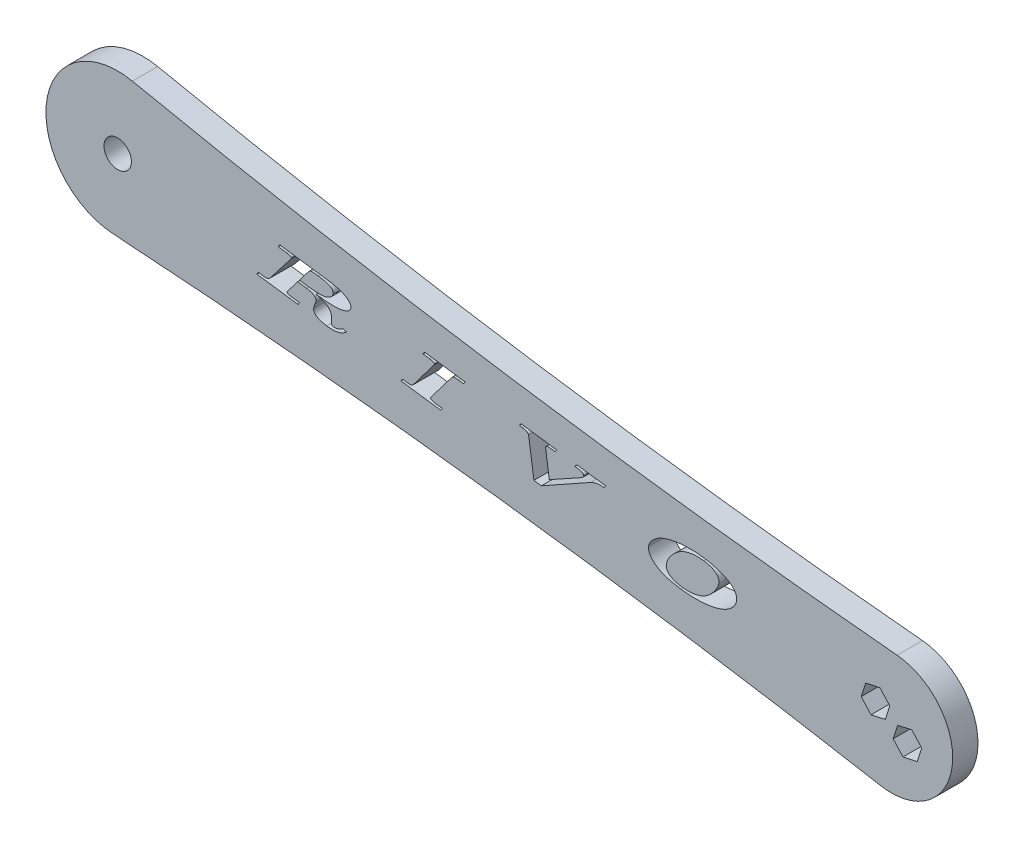
from build123d import *

# Parameters (mm, degrees)
SKETCH1_R           = 75
BOSS_EXTRUDE1_DEPTH = 6
BOSS_EXTRUDE2_DEPTH = 6
SKETCH3_R           = 92.134388464
CUT_EXTRUDE1_DEPTH  = 6
CUT_EXTRUDE2_DEPTH  = 6
SKETCH5_R           = 3.25
CUT_EXTRUDE3_DEPTH  = 149.252587559


with BuildPart() as part:
    # Sketch1 → Boss-Extrude1 (new body)
    with BuildSketch(Plane.XY):
        Circle(SKETCH1_R)
    extrude(amount=BOSS_EXTRUDE1_DEPTH)

    # Sketch2 → Boss-Extrude2 (add)
    with BuildSketch(Plane(origin=(0, 0, 0), x_dir=(-1, 0, 0), z_dir=(0, 0, -1))):
        with BuildLine():
            ThreePointArc((128.747209027, -9.416387205), (37.517810484, -17.965524255), (-53.074069815, -31.713328687))
            ThreePointArc((-53.074069815, -31.713328687), (-70.025516623, -19.404438893), (-56.988213603, -3.006602243))
            ThreePointArc((-56.988213603, -3.006602243), (33.977314711, 8.000829854), (124.165294646, 24.187836312))
            ThreePointArc((124.165294646, 24.187836312), (144.489624717, 9.844563411), (128.747209027, -9.416387205))
        make_face()
    extrude(amount=BOSS_EXTRUDE2_DEPTH)

    # Sketch3 → Cut-Extrude1 (cut)
    with BuildSketch(Plane.XY.offset(6)):
        Circle(SKETCH3_R)
    extrude(amount=-CUT_EXTRUDE1_DEPTH, mode=Mode.SUBTRACT)

    # Sketch4 → Cut-Extrude2 (cut)
    # profile 1 of 4: a face of its own
    with BuildSketch(Plane.XY):
        with BuildLine():
            Line((-89.199235465, 8.056350218), (-78.633328021, 6.61007346))
            add(Edge.make_bspline(
                [(-78.633328021, 6.61007346), (-78.46967753, 6.587082198), (-78.151590929, 6.542394203), (-77.689236729, 6.47400477), (-77.256539996, 6.400685191), (-76.851936412, 6.333885662), (-76.478357712, 6.25852778), (-76.132956577, 6.188507141), (-75.817031153, 6.11514295), (-75.616548577, 6.063172267), (-75.520729798, 6.038333363)],
                knots=[0, 0, 0, 0, 1.252522044, 2.434520528, 3.542164078, 4.578738111, 5.542259448, 6.430319151, 7.24978566, 8, 8, 8, 8], degree=3))
            add(Edge.make_bspline(
                [(-75.520729798, 6.038333363), (-75.395696417, 6.002255621), (-75.15122404, 5.931714369), (-74.797988079, 5.813162632), (-74.466458687, 5.687628696), (-74.157180162, 5.55372731), (-73.869121186, 5.413580031), (-73.60406241, 5.264544499), (-73.359321994, 5.111230758), (-73.140687987, 4.947303731), (-72.944171454, 4.781964658), (-72.777761586, 4.610579982), (-72.640999972, 4.436529345), (-72.531455627, 4.260865466), (-72.453109988, 4.080858684), (-72.406044219, 3.898117918), (-72.384686412, 3.712653718), (-72.396521626, 3.589610166), (-72.402489402, 3.52756682)],
                knots=[0, 0, 0, 0, 1.448769525, 2.832716552, 4.147188601, 5.394567615, 6.583904287, 7.712022436, 8.778948357, 9.796631487, 10.752067049, 11.635656237, 12.451084726, 13.212441746, 13.934654233, 14.627076443, 15.307718526, 16, 16, 16, 16], degree=3))
            add(Edge.make_bspline(
                [(-72.402489402, 3.52756682), (-72.412683853, 3.471960345), (-72.433057021, 3.36083322), (-72.495000346, 3.200657144), (-72.582702896, 3.050261087), (-72.693339621, 2.9060145), (-72.832434457, 2.774143122), (-72.993609833, 2.646638649), (-73.180513186, 2.528921963), (-73.392117805, 2.419981398), (-73.627638681, 2.32121473), (-73.885567435, 2.230698829), (-74.167314971, 2.152500023), (-74.471016737, 2.083223406), (-74.798003171, 2.024919962), (-75.148287654, 1.978787392), (-75.521520622, 1.94175629), (-75.920909388, 1.91263529), (-76.353768931, 1.897195352), (-76.827314074, 1.901295574), (-77.34532131, 1.915738988), (-77.907663282, 1.947482657), (-78.51480605, 1.989461141), (-79.165334221, 2.05173549), (-79.860178302, 2.12409087), (-80.337352757, 2.182693778), (-80.583638812, 2.212940743)],
                knots=[0, 0, 0, 0, 0.460768848, 0.920826524, 1.393133572, 1.878379936, 2.399569821, 2.953505336, 3.554089076, 4.199616045, 4.894506573, 5.637474017, 6.429784344, 7.280262957, 8.179792754, 9.14031503, 10.163942718, 11.241476693, 12.409115775, 13.698880695, 15.106946604, 16.639440317, 18.296764186, 20.075175391, 21.9742638, 24, 24, 24, 24], degree=3))
            add(Edge.make_bspline(
                [(-80.583638812, 2.212940743), (-80.462498605, 2.183431198), (-80.226392263, 2.1259161), (-79.885021715, 2.032505967), (-79.566752798, 1.934212253), (-79.270441852, 1.834743808), (-78.996324827, 1.732628453), (-78.745540701, 1.624096066), (-78.515752959, 1.517009821), (-78.308789751, 1.402313432), (-78.120008851, 1.285367883), (-77.945760102, 1.165411308), (-77.788674783, 1.03895043), (-77.64322324, 0.910659182), (-77.514811602, 0.776226696), (-77.400266799, 0.637363541), (-77.300745557, 0.494698073), (-77.212677203, 0.344247488), (-77.139817286, 0.176718343), (-77.082536842, -0.014655107), (-77.037904577, -0.232432671), (-77.006816545, -0.477621054), (-76.988719757, -0.750158645), (-76.983779907, -1.050133168), (-76.991297983, -1.377019731), (-77.006252716, -1.603718866), (-77.014024655, -1.72153387)],
                knots=[0, 0, 0, 0, 1.481242736, 2.886991985, 4.203931216, 5.438089803, 6.600088731, 7.6778042, 8.683911164, 9.610604467, 10.48693373, 11.321635508, 12.12189989, 12.881444329, 13.62418792, 14.327969556, 15.018061041, 15.688748474, 16.395832791, 17.182711017, 18.057678265, 19.03415483, 20.11667221, 21.301106396, 22.597391388, 24, 24, 24, 24], degree=3))
            add(Edge.make_bspline(
                [(-77.014024655, -1.72153387), (-77.014991635, -1.76736437), (-77.01682107, -1.85407139), (-76.99464735, -1.978819447), (-76.947158933, -2.087502567), (-76.876580963, -2.180944585), (-76.78471998, -2.259644388), (-76.668104801, -2.318692909), (-76.531784175, -2.366984965), (-76.431410633, -2.382740932), (-76.378339943, -2.391071614)],
                knots=[0, 0, 0, 0, 1.055741748, 1.997364664, 2.897429717, 3.765081255, 4.677949824, 5.661288235, 6.763448575, 8, 8, 8, 8], degree=3))
            add(Edge.make_bspline(
                [(-76.378339943, -2.391071614), (-76.301294195, -2.398974928), (-76.144751998, -2.415032947), (-75.904414487, -2.396785264), (-75.657620992, -2.351688172), (-75.405267112, -2.272941856), (-75.146371885, -2.164370777), (-74.881250333, -2.026197037), (-74.60874572, -1.858128095), (-74.431484687, -1.727273555), (-74.339635124, -1.659469978)],
                knots=[0, 0, 0, 0, 0.835137947, 1.696840279, 2.592029055, 3.540952508, 4.545759258, 5.620936426, 6.767264615, 8, 8, 8, 8], degree=3))
            Line((-74.339635124, -1.659469978), (-73.414318915, -1.905844822))
            add(Edge.make_bspline(
                [(-73.414318915, -1.905844822), (-73.485006791, -1.967602389), (-73.625871159, -2.090670745), (-73.851003223, -2.258269681), (-74.086531377, -2.411024818), (-74.333504303, -2.548550902), (-74.591794757, -2.670801483), (-74.860404687, -2.77834936), (-75.140562276, -2.867942837), (-75.430904008, -2.945759287), (-75.732911777, -3.007840949), (-76.045905746, -3.051509738), (-76.368881781, -3.084953436), (-76.703566853, -3.098896674), (-77.049240778, -3.098186911), (-77.405699397, -3.085855193), (-77.772721866, -3.055319341), (-78.020316875, -3.023917249), (-78.146220505, -3.007949087)],
                knots=[0, 0, 0, 0, 0.896627271, 1.786767998, 2.67900242, 3.57732889, 4.485665322, 5.407802043, 6.339808508, 7.294428838, 8.278897195, 9.283604995, 10.312974251, 11.380301643, 12.482493739, 13.615412946, 14.787422377, 16, 16, 16, 16], degree=3))
            add(Edge.make_bspline(
                [(-78.146220505, -3.007949087), (-78.272414709, -2.989623075), (-78.518108682, -2.95394322), (-78.872999646, -2.883598863), (-79.205373856, -2.805599045), (-79.513435184, -2.715278721), (-79.799023648, -2.616207467), (-80.060308886, -2.505438827), (-80.299099421, -2.385177546), (-80.5134072, -2.254287115), (-80.701672742, -2.114421456), (-80.86106845, -1.966195209), (-80.995343517, -1.814372497), (-81.098284319, -1.652347398), (-81.172710304, -1.48362674), (-81.218438029, -1.307842952), (-81.236503371, -1.125380975), (-81.22510377, -1.003058079), (-81.219323524, -0.941033409)],
                knots=[0, 0, 0, 0, 1.500131662, 2.920683313, 4.255335032, 5.515768824, 6.696180242, 7.810000424, 8.852412398, 9.839161177, 10.761177534, 11.606702226, 12.396361734, 13.139156789, 13.855895086, 14.557209601, 15.26842316, 16, 16, 16, 16], degree=3))
            add(Edge.make_bspline(
                [(-81.219323524, -0.941033409), (-81.208516596, -0.877469105), (-81.184622644, -0.736929411), (-81.118701797, -0.511779332), (-81.033198816, -0.250210356), (-80.960840275, -0.066748212), (-80.922169132, 0.0313009)],
                knots=[0, 0, 0, 0, 0.758861538, 1.67783115, 2.758945083, 4, 4, 4, 4], degree=3))
            add(Edge.make_bspline(
                [(-80.922169132, 0.0313009), (-80.887642697, 0.120711398), (-80.825187069, 0.282448014), (-80.749977256, 0.503405879), (-80.696184072, 0.67537357), (-80.676430347, 0.775916079), (-80.668271392, 0.817443533)],
                knots=[0, 0, 0, 0, 1.390064171, 2.514517663, 3.386445588, 4, 4, 4, 4], degree=3))
            add(Edge.make_bspline(
                [(-80.668271392, 0.817443533), (-80.663693078, 0.865037313), (-80.654711862, 0.958401378), (-80.666116902, 1.097807784), (-80.700982932, 1.230808673), (-80.755398013, 1.358586599), (-80.834859638, 1.477812051), (-80.933698661, 1.591995459), (-81.055474146, 1.698599848), (-81.196543756, 1.800010764), (-81.357852592, 1.893446702), (-81.535283716, 1.981701617), (-81.731414022, 2.060265145), (-81.943925403, 2.133991188), (-82.17464606, 2.198715483), (-82.422423862, 2.257340339), (-82.68726427, 2.307978179), (-82.870484342, 2.334648056), (-82.964635398, 2.348352871)],
                knots=[0, 0, 0, 0, 0.751972739, 1.475134623, 2.188730362, 2.909529516, 3.651650801, 4.435547375, 5.281695827, 6.194137317, 7.167770729, 8.214219262, 9.312436284, 10.492666633, 11.755257551, 13.08434552, 14.501736485, 16, 16, 16, 16], degree=3))
            Line((-82.964635398, 2.348352871), (-84.988294425, 2.624819299))
            Line((-84.988294425, 2.624819299), (-87.446400695, -0.5799344))
            add(Edge.make_bspline(
                [(-87.446400695, -0.5799344), (-87.460598235, -0.59667424), (-87.487719024, -0.628651446), (-87.496674394, -0.669535059), (-87.500941691, -0.689016392)],
                knots=[0, 0, 0, 0, 1.046985717, 2, 2, 2, 2], degree=3))
            add(Edge.make_bspline(
                [(-87.500941691, -0.689016392), (-87.501247279, -0.715785234), (-87.50188718, -0.771839256), (-87.456171465, -0.853586193), (-87.375803199, -0.923630608), (-87.265949192, -0.995054099), (-87.117630148, -1.057177494), (-86.930130494, -1.10944361), (-86.705782341, -1.161093112), (-86.541387804, -1.184357288), (-86.453378422, -1.196811873)],
                knots=[0, 0, 0, 0, 0.507842969, 1.063424455, 1.72884683, 2.548447001, 3.57467618, 4.80729643, 6.290771278, 8, 8, 8, 8], degree=3))
            Line((-86.453378422, -1.196811873), (-84.548205008, -1.458232509))
            Line((-84.548205008, -1.458232509), (-84.907423293, -2.005523194))
            Line((-84.907423293, -2.005523194), (-94.692830276, -0.66456698))
            Line((-94.692830276, -0.66456698), (-94.280951719, -0.124799192))
            Line((-94.280951719, -0.124799192), (-93.171324558, -0.277137836))
            add(Edge.make_bspline(
                [(-93.171324558, -0.277137836), (-93.067395026, -0.289934215), (-92.872513575, -0.313929098), (-92.597113797, -0.325214795), (-92.359006486, -0.318252859), (-92.153408165, -0.287773458), (-91.975740302, -0.229312355), (-91.81720776, -0.150636576), (-91.677121799, -0.045117695), (-91.599011275, 0.040633405), (-91.559544088, 0.083961172)],
                knots=[0, 0, 0, 0, 1.450224059, 2.719359585, 3.81457851, 4.746993374, 5.587457969, 6.395384877, 7.189230321, 8, 8, 8, 8], degree=3))
            Line((-91.559544088, 0.083961172), (-86.648973719, 6.427643232))
            add(Edge.make_bspline(
                [(-86.648973719, 6.427643232), (-86.615248818, 6.471681735), (-86.551979343, 6.554300006), (-86.527072784, 6.655140189), (-86.515442314, 6.702228936)],
                knots=[0, 0, 0, 0, 1.066071778, 2, 2, 2, 2], degree=3))
            add(Edge.make_bspline(
                [(-86.515442314, 6.702228936), (-86.514700539, 6.732251108), (-86.513198003, 6.793063918), (-86.562227001, 6.879006118), (-86.641669502, 6.955820541), (-86.75888455, 7.024367507), (-86.916141781, 7.0889561), (-87.119872968, 7.144280575), (-87.37108256, 7.196776379), (-87.555289538, 7.223659858), (-87.65516106, 7.238235277)],
                knots=[0, 0, 0, 0, 0.523624767, 1.060652581, 1.689600085, 2.473343506, 3.450049065, 4.69931559, 6.2104675, 8, 8, 8, 8], degree=3))
            Line((-87.65516106, 7.238235277), (-89.612994746, 7.507178809))
            Line((-89.612994746, 7.507178809), (-89.199235465, 8.056350218))
        make_face()
        with BuildLine():
            Line((-84.578296592, 3.157064192), (-82.620462906, 2.88812066))
            add(Edge.make_bspline(
                [(-82.620462906, 2.88812066), (-82.49888038, 2.872149837), (-82.259644506, 2.84072432), (-81.906641847, 2.799539375), (-81.5668205, 2.763991242), (-81.240301648, 2.732903328), (-80.92607716, 2.710843615), (-80.624504105, 2.693984233), (-80.335485459, 2.681780152), (-80.059551413, 2.678606857), (-79.796811753, 2.680059756), (-79.54662109, 2.687837579), (-79.309430321, 2.69989788), (-79.084963647, 2.721142203), (-78.873539583, 2.747199252), (-78.674705047, 2.77919248), (-78.487821073, 2.815414958), (-78.369229447, 2.847912937), (-78.311724217, 2.863671248)],
                knots=[0, 0, 0, 0, 1.358066348, 2.672244106, 3.935819342, 5.142072379, 6.304531309, 7.424088301, 8.487173197, 9.507878466, 10.479913558, 11.396801095, 12.279891661, 13.109622714, 13.893282468, 14.638637687, 15.339873686, 16, 16, 16, 16], degree=3))
            add(Edge.make_bspline(
                [(-78.311724217, 2.863671248), (-78.188686821, 2.901540776), (-77.953397512, 2.973960181), (-77.628518324, 3.113209336), (-77.346353512, 3.270823647), (-77.108474662, 3.4495355), (-76.914917636, 3.649261025), (-76.764824662, 3.868427213), (-76.660025937, 4.109435278), (-76.62780184, 4.280229964), (-76.611549719, 4.366369725)],
                knots=[0, 0, 0, 0, 1.28183404, 2.451302246, 3.514176146, 4.49477397, 5.404721905, 6.272607249, 7.128794912, 8, 8, 8, 8], degree=3))
            add(Edge.make_bspline(
                [(-76.611549719, 4.366369725), (-76.606556546, 4.421505866), (-76.596721271, 4.53010997), (-76.614261009, 4.69210963), (-76.659957867, 4.847007319), (-76.735099316, 4.993362108), (-76.83701487, 5.131860689), (-76.964236213, 5.264551879), (-77.120391891, 5.388582647), (-77.305390094, 5.505717182), (-77.521991867, 5.616699873), (-77.77380924, 5.722470532), (-78.065122171, 5.818296833), (-78.39321973, 5.911937242), (-78.759715391, 5.999969328), (-79.163604223, 6.082523796), (-79.606168112, 6.156610024), (-79.91401172, 6.201303161), (-80.073962607, 6.22452504)],
                knots=[0, 0, 0, 0, 0.617353154, 1.216027908, 1.807737976, 2.412283829, 3.044127956, 3.722801281, 4.460061822, 5.266383265, 6.165446382, 7.176196068, 8.314655389, 9.589417228, 10.987516552, 12.524604999, 14.194237279, 16, 16, 16, 16], degree=3))
            add(Edge.make_bspline(
                [(-80.073962607, 6.22452504), (-80.180534765, 6.238312225), (-80.383576304, 6.264579605), (-80.673507077, 6.302157851), (-80.934013138, 6.326749136), (-81.164479, 6.349513664), (-81.365902991, 6.360450141), (-81.537779043, 6.364884206), (-81.68036271, 6.36201067), (-81.828581589, 6.348250354), (-81.98871187, 6.309712699), (-82.161252571, 6.231957284), (-82.315319497, 6.119076645), (-82.397849951, 6.021990234), (-82.439913402, 5.972508023)],
                knots=[0, 0, 0, 0, 1.550362766, 2.953754966, 4.217281606, 5.32516964, 6.294436517, 7.12671429, 7.80528248, 8.350650677, 9.271977639, 10.166455305, 11.06549387, 12, 12, 12, 12], degree=3))
            Line((-82.439913402, 5.972508023), (-84.578296592, 3.157064192))
        make_face(mode=Mode.SUBTRACT)
    # profile 2 of 4: a face of its own
    with BuildSketch(Plane.XY):
        with BuildLine():
            Line((-54.937439067, 3.198090731), (-45.323177968, 1.881583929))
            Line((-45.323177968, 1.881583929), (-45.72377218, 1.328651073))
            Line((-45.72377218, 1.328651073), (-46.846564409, 1.482870441))
            add(Edge.make_bspline(
                [(-46.846564409, 1.482870441), (-46.909218777, 1.491319343), (-47.029988571, 1.507605073), (-47.204954573, 1.526306283), (-47.366733938, 1.540033867), (-47.51541337, 1.546700826), (-47.650889895, 1.552330278), (-47.772605131, 1.547455335), (-47.881301246, 1.540877932), (-48.005419678, 1.524213971), (-48.143030588, 1.488590198), (-48.289365001, 1.424442378), (-48.415046, 1.33734567), (-48.480425942, 1.262413627), (-48.512885875, 1.225211253)],
                knots=[0, 0, 0, 0, 1.290354187, 2.487229806, 3.591313925, 4.603482592, 5.525140589, 6.357265751, 7.088424035, 7.747131748, 8.910993306, 9.976359935, 10.995300116, 12, 12, 12, 12], degree=3))
            Line((-48.512885875, 1.225211253), (-53.466712897, -5.329111895))
            add(Edge.make_bspline(
                [(-53.466712897, -5.329111895), (-53.486332223, -5.35830353), (-53.521811654, -5.411093445), (-53.537022839, -5.472712621), (-53.543822581, -5.500257779)],
                knots=[0, 0, 0, 0, 1.105954985, 2, 2, 2, 2], degree=3))
            add(Edge.make_bspline(
                [(-53.543822581, -5.500257779), (-53.545324906, -5.5290606), (-53.548333992, -5.586751289), (-53.500913201, -5.666250692), (-53.428067767, -5.737170107), (-53.36214832, -5.768683553), (-53.325658597, -5.786127827)],
                knots=[0, 0, 0, 0, 0.875272292, 1.753129054, 2.756244144, 4, 4, 4, 4], degree=3))
            add(Edge.make_bspline(
                [(-53.325658597, -5.786127827), (-53.256511245, -5.813734174), (-53.105090445, -5.874187323), (-52.847000964, -5.94305839), (-52.54142267, -6.00393791), (-52.320895561, -6.037244961), (-52.202866367, -6.05507136)],
                knots=[0, 0, 0, 0, 0.771158155, 1.688703649, 2.762961857, 4, 4, 4, 4], degree=3))
            Line((-52.202866367, -6.05507136), (-50.77539685, -6.250666656))
            Line((-50.77539685, -6.250666656), (-51.174110338, -6.792315169))
            Line((-51.174110338, -6.792315169), (-60.562684557, -5.505899951))
            Line((-60.562684557, -5.505899951), (-60.150806001, -4.966132162))
            Line((-60.150806001, -4.966132162), (-59.093839111, -5.110947911))
            add(Edge.make_bspline(
                [(-59.093839111, -5.110947911), (-59.003684413, -5.122181863), (-58.831930157, -5.143583732), (-58.58546911, -5.155402033), (-58.364094077, -5.148176592), (-58.168269004, -5.125879162), (-57.997660182, -5.082919235), (-57.852673211, -5.021536745), (-57.731718963, -4.940329778), (-57.671304394, -4.87038277), (-57.641920182, -4.836362206)],
                knots=[0, 0, 0, 0, 1.414245087, 2.69428678, 3.8370001, 4.860052316, 5.757328466, 6.566085444, 7.302578, 8, 8, 8, 8], degree=3))
            Line((-57.641920182, -4.836362206), (-52.7069004, 1.689750081))
            add(Edge.make_bspline(
                [(-52.7069004, 1.689750081), (-52.68234842, 1.724956358), (-52.636238542, 1.791075551), (-52.617747791, 1.869409583), (-52.609102752, 1.906033341)],
                knots=[0, 0, 0, 0, 1.064933642, 2, 2, 2, 2], degree=3))
            add(Edge.make_bspline(
                [(-52.609102752, 1.906033341), (-52.608468895, 1.93417911), (-52.607166292, 1.992019806), (-52.656800155, 2.074411421), (-52.737108064, 2.147109362), (-52.853654016, 2.215934467), (-53.012681582, 2.279246093), (-53.220530765, 2.338270987), (-53.481327709, 2.38871519), (-53.672839369, 2.417160327), (-53.777032357, 2.432636062)],
                knots=[0, 0, 0, 0, 0.484307154, 0.995270836, 1.616671547, 2.375666175, 3.350485636, 4.608524891, 6.154849036, 8, 8, 8, 8], degree=3))
            Line((-53.777032357, 2.432636062), (-55.309822419, 2.641396426))
            Line((-55.309822419, 2.641396426), (-54.937439067, 3.198090731))
        make_face()
    # profile 3 of 4: a face of its own
    with BuildSketch(Plane.XY):
        with BuildLine():
            Line((-32.060077507, -0.053435993), (-23.596819497, -1.213842702))
            Line((-23.596819497, -1.213842702), (-23.995532986, -1.761133387))
            Line((-23.995532986, -1.761133387), (-24.697043039, -1.663335739))
            add(Edge.make_bspline(
                [(-24.697043039, -1.663335739), (-24.762213465, -1.654986461), (-24.887399645, -1.638948294), (-25.06849899, -1.618990586), (-25.236122515, -1.609088534), (-25.389668183, -1.599854769), (-25.529641783, -1.600353749), (-25.655813338, -1.605486112), (-25.768890808, -1.616541287), (-25.895366811, -1.637061887), (-26.027138703, -1.677756875), (-26.15497939, -1.744885783), (-26.243700604, -1.840081744), (-26.263420993, -1.917090929), (-26.273089752, -1.954847959)],
                knots=[0, 0, 0, 0, 1.370329213, 2.632271884, 3.79854312, 4.87192642, 5.839438966, 6.716307753, 7.504689976, 8.207558034, 9.386076985, 10.36395823, 11.197860888, 12, 12, 12, 12], degree=3))
            add(Edge.make_bspline(
                [(-26.273089752, -1.954847959), (-26.275129017, -1.993811464), (-26.279796163, -2.082984977), (-26.262270041, -2.170662414), (-26.252401788, -2.220030043)],
                knots=[0, 0, 0, 0, 0.873880672, 2, 2, 2, 2], degree=3))
            Line((-26.252401788, -2.220030043), (-25.415479607, -8.189448026))
            Line((-25.415479607, -8.189448026), (-17.819235363, -3.984149157))
            add(Edge.make_bspline(
                [(-17.819235363, -3.984149157), (-17.777561272, -3.959553038), (-17.697841561, -3.912502328), (-17.587912331, -3.837263414), (-17.49308731, -3.76028641), (-17.414024442, -3.681236743), (-17.348485232, -3.601918259), (-17.299003339, -3.5203093), (-17.263451147, -3.436709587), (-17.252759017, -3.378836282), (-17.247495266, -3.350345168)],
                knots=[0, 0, 0, 0, 1.314704517, 2.514940651, 3.616456865, 4.628304449, 5.548843541, 6.404858792, 7.214709619, 8, 8, 8, 8], degree=3))
            add(Edge.make_bspline(
                [(-17.247495266, -3.350345168), (-17.245174542, -3.324639021), (-17.240567087, -3.273603252), (-17.252555295, -3.197258596), (-17.27987856, -3.124062335), (-17.321863581, -3.053946872), (-17.379437828, -2.987606351), (-17.452438413, -2.925520054), (-17.539606477, -2.865481617), (-17.642568846, -2.806599373), (-17.765015807, -2.749544703), (-17.911026555, -2.695431887), (-18.082020819, -2.643487501), (-18.278126132, -2.593570937), (-18.49804141, -2.542494214), (-18.743314371, -2.493811044), (-19.013799677, -2.447512732), (-19.202782974, -2.417892711), (-19.301245876, -2.402460271)],
                knots=[0, 0, 0, 0, 0.507883981, 1.008328816, 1.509385069, 2.04198643, 2.612339823, 3.235044542, 3.92835761, 4.698750849, 5.573282993, 6.591309055, 7.76931767, 9.098735596, 10.58438753, 12.224692437, 14.033012714, 16, 16, 16, 16], degree=3))
            Line((-19.301245876, -2.402460271), (-18.86115646, -1.860811759))
            Line((-18.86115646, -1.860811759), (-12.051054848, -2.793650864))
            Line((-12.051054848, -2.793650864), (-12.45164906, -3.340941548))
            add(Edge.make_bspline(
                [(-12.45164906, -3.340941548), (-12.608885346, -3.327081646), (-12.913560745, -3.300225433), (-13.359634346, -3.293072626), (-13.779478739, -3.312515897), (-14.17562857, -3.361368884), (-14.552122873, -3.43833023), (-14.91249073, -3.547298584), (-15.26215089, -3.680116934), (-15.482512964, -3.795120022), (-15.592458144, -3.852498477)],
                knots=[0, 0, 0, 0, 1.171228331, 2.269479072, 3.3083455, 4.288305194, 5.229130806, 6.156572066, 7.08025908, 8, 8, 8, 8], degree=3))
            Line((-15.592458144, -3.852498477), (-27.279277093, -10.388014385))
            Line((-27.279277093, -10.388014385), (-29.037754035, -10.147281712))
            Line((-29.037754035, -10.147281712), (-30.297839117, -1.544850126))
            add(Edge.make_bspline(
                [(-30.297839117, -1.544850126), (-30.310220243, -1.49123968), (-30.335047217, -1.383738543), (-30.422835526, -1.235746896), (-30.551628501, -1.107711588), (-30.71616552, -0.991034039), (-30.923131316, -0.895967803), (-31.166001358, -0.811404439), (-31.449296669, -0.744912632), (-31.651711342, -0.71338161), (-31.759161667, -0.696643601)],
                knots=[0, 0, 0, 0, 0.729075388, 1.461961965, 2.252807059, 3.132734902, 4.133083612, 5.27327797, 6.552539869, 8, 8, 8, 8], degree=3))
            Line((-31.759161667, -0.696643601), (-32.485121131, -0.596965229))
            Line((-32.485121131, -0.596965229), (-32.060077507, -0.053435993))
        make_face()
    # profile 4 of 4: a face of its own
    with BuildSketch(Plane.XY):
        with BuildLine():
            add(Edge.make_bspline(
                [(11.264207737, -5.921837207), (11.417242502, -5.943942592), (11.719919757, -5.987663359), (12.167185258, -6.06049926), (12.601549987, -6.141718738), (13.022858603, -6.228379886), (13.432318876, -6.319287545), (13.827758338, -6.422422805), (14.212271217, -6.526267253), (14.58339049, -6.639714383), (14.941503055, -6.759453984), (15.286801708, -6.886194798), (15.620208449, -7.017518343), (15.941260039, -7.155663334), (16.248397515, -7.303618416), (16.543506841, -7.455373629), (16.826454283, -7.613005606), (17.094219073, -7.778591098), (17.348356264, -7.946993554), (17.583906108, -8.119416906), (17.803124763, -8.292854676), (18.000655189, -8.472148762), (18.185160531, -8.649285452), (18.346682126, -8.833201767), (18.491862389, -9.017653035), (18.62158356, -9.20325518), (18.727903684, -9.394617347), (18.819983102, -9.586708853), (18.890679753, -9.783029407), (18.946237869, -9.980803585), (18.982035689, -10.181089089), (18.999015406, -10.383796334), (18.997333642, -10.589065202), (18.982594417, -10.725915936), (18.975176146, -10.794793097)],
                knots=[0, 0, 0, 0, 1.494717946, 2.956302913, 4.380276963, 5.766109736, 7.114302302, 8.434235066, 9.71626872, 10.964290651, 12.185058741, 13.366084164, 14.519594193, 15.648777101, 16.743879538, 17.814511207, 18.856387198, 19.873956149, 20.857236569, 21.802719055, 22.695228798, 23.557856974, 24.380673476, 25.166293347, 25.92159576, 26.649461222, 27.35229778, 28.035472527, 28.706497118, 29.366651292, 30.019279784, 30.670020311, 31.330619408, 32, 32, 32, 32], degree=3))
            add(Edge.make_bspline(
                [(18.975176146, -10.794793097), (18.954954605, -10.912722886), (18.914538253, -11.148426585), (18.799622164, -11.491913657), (18.646483762, -11.825687101), (18.453470278, -12.151853589), (18.21596855, -12.465621427), (17.93976607, -12.772070577), (17.621038344, -13.067469674), (17.386166873, -13.249652465), (17.265598028, -13.34317412)],
                knots=[0, 0, 0, 0, 0.909744995, 1.818287484, 2.747257009, 3.701598941, 4.697127374, 5.737910128, 6.838779513, 8, 8, 8, 8], degree=3))
            add(Edge.make_bspline(
                [(17.265598028, -13.34317412), (17.116225775, -13.448656266), (16.811265819, -13.664009721), (16.310489373, -13.943226288), (15.770495248, -14.202296365), (15.184276827, -14.430334232), (14.556387614, -14.634993355), (13.884227031, -14.812725228), (13.170262224, -14.967145674), (12.417307637, -15.09038398), (11.637660057, -15.190102347), (10.839576938, -15.259426609), (10.028377458, -15.298353697), (9.20415616, -15.309180168), (8.366622618, -15.29341836), (7.51622883, -15.242498885), (6.652379172, -15.166892322), (6.073825412, -15.093530688), (5.78189727, -15.056513686)],
                knots=[0, 0, 0, 0, 0.739641611, 1.510060066, 2.316975122, 3.162255573, 4.053698036, 4.988582951, 5.974947281, 7.009008624, 8.075571481, 9.155472159, 10.250342797, 11.361781441, 12.491107769, 13.639860039, 14.809114517, 16, 16, 16, 16], degree=3))
            add(Edge.make_bspline(
                [(5.78189727, -15.056513686), (5.613139372, -15.032848278), (5.281377226, -14.986324313), (4.79384119, -14.904254455), (4.323299763, -14.818616423), (3.869881049, -14.724673873), (3.434246466, -14.622956447), (3.015657405, -14.516298587), (2.615165133, -14.401262094), (2.231426978, -14.280771082), (1.864066833, -14.156384987), (1.516179316, -14.019746687), (1.184913199, -13.878910144), (0.870356818, -13.733251917), (0.574918924, -13.578122419), (0.295608189, -13.418727074), (0.033693262, -13.251347008), (-0.21027586, -13.076351326), (-0.437258366, -12.897785927), (-0.64803774, -12.719019376), (-0.84376438, -12.540714392), (-1.018628457, -12.35732518), (-1.183280237, -12.177569109), (-1.326014037, -11.992514968), (-1.458545492, -11.810125169), (-1.57044706, -11.62390971), (-1.667196819, -11.437567664), (-1.746508964, -11.25000132), (-1.810869277, -11.062300309), (-1.858551277, -10.872993038), (-1.888163612, -10.682179264), (-1.903614501, -10.490453708), (-1.902490591, -10.297715866), (-1.887623472, -10.170304575), (-1.880172314, -10.106448112)],
                knots=[0, 0, 0, 0, 1.643808593, 3.231573007, 4.768849405, 6.257353877, 7.697898084, 9.084009135, 10.423927812, 11.71692338, 12.963870134, 14.16441842, 15.32140521, 16.436081784, 17.507255603, 18.539410108, 19.537572997, 20.504222157, 21.434567857, 22.322739555, 23.170135376, 23.987007092, 24.766465392, 25.520184622, 26.240075797, 26.940160403, 27.613645187, 28.264006566, 28.902764309, 29.526135021, 30.144557801, 30.763305763, 31.380188998, 32, 32, 32, 32], degree=3))
            add(Edge.make_bspline(
                [(-1.880172314, -10.106448112), (-1.862292923, -10.004819798), (-1.825869001, -9.797782453), (-1.716236013, -9.493156722), (-1.566645034, -9.189625457), (-1.374798604, -8.887634081), (-1.140508099, -8.587358091), (-0.865550432, -8.286305571), (-0.545840962, -7.988397439), (-0.186716719, -7.689717766), (0.219979357, -7.401099494), (0.67807334, -7.132666335), (1.186800022, -6.887626851), (1.742988181, -6.659502766), (2.350420973, -6.454377721), (3.006558432, -6.265944762), (3.713377399, -6.102704086), (4.462653437, -5.956370329), (5.246048353, -5.835985172), (6.053814538, -5.75045416), (6.879483598, -5.696169288), (7.722686212, -5.673455356), (8.583484435, -5.685036982), (9.461606976, -5.731387218), (10.358144806, -5.807304587), (10.959763771, -5.883353385), (11.264207737, -5.921837207)],
                knots=[0, 0, 0, 0, 0.499413713, 1.017406316, 1.562372677, 2.137343425, 2.748204703, 3.406405889, 4.111518956, 4.864772955, 5.669129749, 6.525923465, 7.43513107, 8.404046874, 9.438051415, 10.541259723, 11.711755244, 12.953141186, 14.241154176, 15.552260334, 16.889188958, 18.251047274, 19.639885939, 21.060865426, 22.512676898, 24, 24, 24, 24], degree=3))
        make_face()
        with BuildLine():
            add(Edge.make_bspline(
                [(11.220951085, -6.531191784), (11.037445649, -6.508760954), (10.674309894, -6.464372968), (10.132537472, -6.428901591), (9.600914372, -6.421816789), (9.078383471, -6.438846909), (8.56578955, -6.489645891), (8.062460744, -6.561243904), (7.569659978, -6.663983948), (7.086015312, -6.792747794), (6.612882693, -6.953372935), (6.153658387, -7.153534918), (5.704643451, -7.385062683), (5.271864258, -7.661004176), (4.849661549, -7.968626449), (4.44256828, -8.316415969), (4.043922643, -8.696246929), (3.797004257, -8.975501511), (3.67172494, -9.117187287)],
                knots=[0, 0, 0, 0, 1.061394894, 2.100376135, 3.115607356, 4.113387281, 5.10056542, 6.071897399, 7.031330014, 7.98922846, 8.944329345, 9.897236584, 10.863284639, 11.842025766, 12.841382369, 13.86046732, 14.9144624, 16, 16, 16, 16], degree=3))
            add(Edge.make_bspline(
                [(3.67172494, -9.117187287), (3.577017771, -9.229618489), (3.392464219, -9.448710433), (3.144569051, -9.78591394), (2.927078577, -10.117893367), (2.739553383, -10.444102843), (2.58715524, -10.767362468), (2.463074826, -11.083246377), (2.372795576, -11.395705484), (2.337055626, -11.604360682), (2.319484382, -11.706944238)],
                knots=[0, 0, 0, 0, 1.191474554, 2.321797422, 3.390285191, 4.407707158, 5.369335271, 6.284826455, 7.156749488, 8, 8, 8, 8], degree=3))
            add(Edge.make_bspline(
                [(2.319484382, -11.706944238), (2.310857217, -11.795867424), (2.293973581, -11.969892933), (2.309058091, -12.228647411), (2.361813728, -12.475410809), (2.452606812, -12.709669703), (2.575116253, -12.933397977), (2.735984903, -13.144431768), (2.933650177, -13.34141075), (3.163970355, -13.527519348), (3.425821197, -13.699786136), (3.715918401, -13.856660001), (4.031776278, -14.000580455), (4.37499569, -14.126987938), (4.744440876, -14.242410928), (5.140934691, -14.340727521), (5.563949273, -14.425898054), (5.855656421, -14.469743475), (6.005703427, -14.492296485)],
                knots=[0, 0, 0, 0, 0.832695886, 1.629612383, 2.407495031, 3.177730174, 3.965773656, 4.780041155, 5.644531386, 6.563584047, 7.538638862, 8.564767227, 9.638047483, 10.774551052, 11.975309462, 13.247909943, 14.584392338, 16, 16, 16, 16], degree=3))
            add(Edge.make_bspline(
                [(6.005703427, -14.492296485), (6.183567113, -14.514118593), (6.536046384, -14.557364298), (7.063424772, -14.590825312), (7.582563859, -14.59635232), (8.092955851, -14.575994688), (8.595187058, -14.528774589), (9.089336394, -14.455668964), (9.575586434, -14.356263043), (10.052019096, -14.228640683), (10.515590493, -14.071639501), (10.964253277, -13.882856246), (11.39506711, -13.661017286), (11.808428334, -13.405043759), (12.206682513, -13.119839209), (12.584125016, -12.797906134), (12.947625561, -12.447602981), (13.285076977, -12.067485933), (13.597237829, -11.680438303), (13.878862489, -11.302821669), (14.121819419, -10.939025223), (14.331277861, -10.591827863), (14.49906203, -10.256004655), (14.631337472, -9.935681752), (14.732233837, -9.630878688), (14.766559436, -9.428682831), (14.783042345, -9.331589823)],
                knots=[0, 0, 0, 0, 1.153637455, 2.286207471, 3.400364025, 4.495172745, 5.573629655, 6.646853897, 7.710033709, 8.767527862, 9.820637064, 10.858975114, 11.898849864, 12.937321289, 13.987021109, 15.049649057, 16.128702586, 17.2349338, 18.319875406, 19.329838694, 20.266894757, 21.135693527, 21.939009666, 22.681122314, 23.366684343, 24, 24, 24, 24], degree=3))
            add(Edge.make_bspline(
                [(14.783042345, -9.331589823), (14.792573465, -9.240782292), (14.811164778, -9.063653978), (14.794229172, -8.800928524), (14.746563868, -8.550369709), (14.660135891, -8.312194746), (14.53883644, -8.086378671), (14.379793986, -7.874815067), (14.18863945, -7.673829104), (13.961334566, -7.489121386), (13.705838845, -7.317111646), (13.424509232, -7.159055766), (13.118789678, -7.016359959), (12.788306672, -6.88819906), (12.431676422, -6.776397173), (12.05095067, -6.67669578), (11.64464637, -6.593720973), (11.364737593, -6.552411878), (11.220951085, -6.531191784)],
                knots=[0, 0, 0, 0, 0.865305522, 1.687856793, 2.488418198, 3.278965237, 4.082991194, 4.912508186, 5.783747301, 6.709451039, 7.686497701, 8.704316007, 9.769111061, 10.886305491, 12.066266451, 13.314714614, 14.620594129, 16, 16, 16, 16], degree=3))
        make_face(mode=Mode.SUBTRACT)
    extrude(amount=-CUT_EXTRUDE2_DEPTH, mode=Mode.SUBTRACT)


with BuildPart() as cut_extrude2_piece_1:
    # of the separate pieces the step leaves, piece 1, a body of its own (cut_extrude2_pieces)
    add(part.part.solids().sort_by_distance((53.074069815, -31.713328687, 0))[0])

    # Sketch5 → Cut-Extrude3 (cut, through all)
    with BuildSketch(Plane.XY):
        with Locations((-127.64547967, 7.547875008)):
            Circle(SKETCH5_R)
        Polygon((55.259798545, -14.276008612), (52.93129447, -11.711234008), (49.54588247, -12.445390388), (48.488974545, -15.744321372), (50.817478621, -18.309095976), (54.202890621, -17.574939597), align=None)
        Polygon((56.057104913, -20.614988958), (58.385608989, -23.179763562), (61.771020989, -22.445607182), (62.827928914, -19.146676198), (60.499424838, -16.581901594), (57.114012838, -17.316057973), align=None)
    extrude(amount=-CUT_EXTRUDE3_DEPTH, mode=Mode.SUBTRACT)


with BuildPart() as cut_extrude2_piece_2:
    # of the separate pieces the step leaves, piece 2, a body of its own (cut_extrude2_pieces)
    add(part.part.solids().sort_by_distance((14.783042345, -9.331589823, 0))[0])


with BuildPart() as cut_extrude2_piece_3:
    # of the separate pieces the step leaves, piece 3, a body of its own (cut_extrude2_pieces)
    add(part.part.solids().sort_by_distance((-82.439913402, 5.972508023, 0))[0])


solid = Compound([cut_extrude2_piece_1.part, cut_extrude2_piece_2.part, cut_extrude2_piece_3.part])
